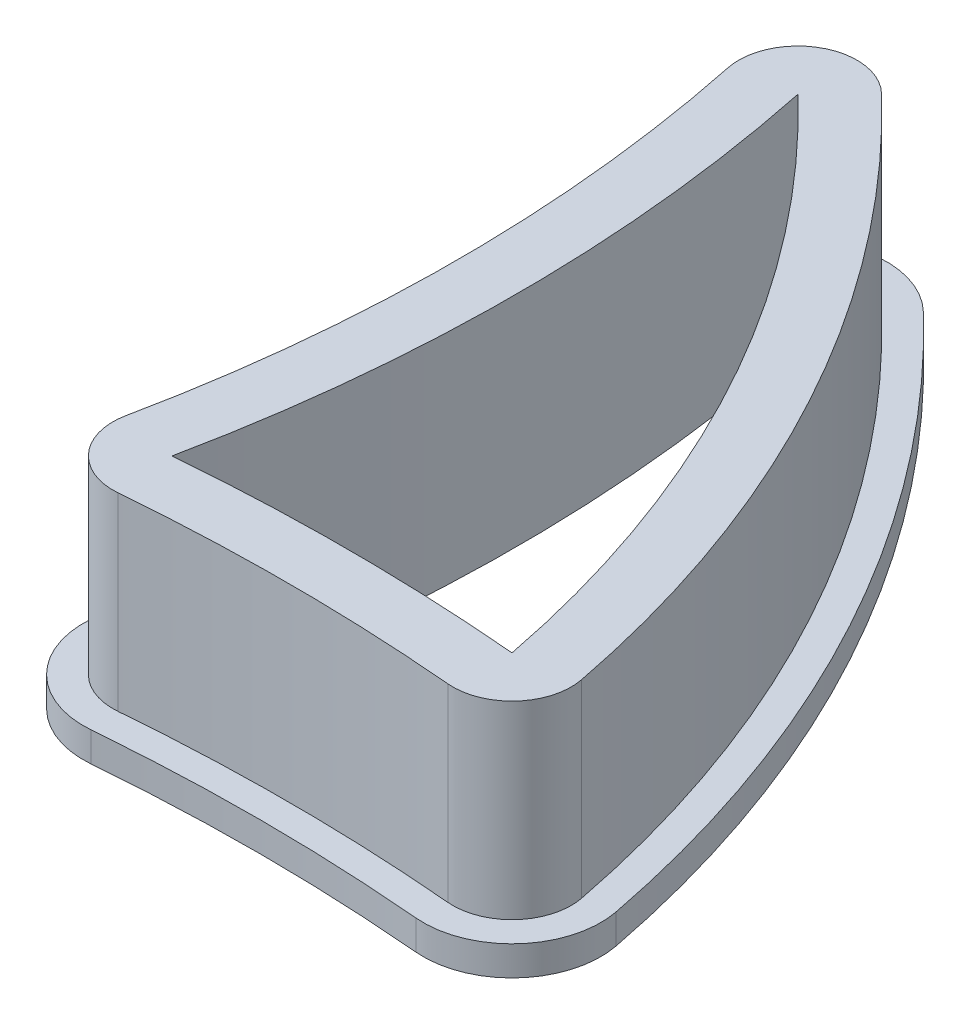
from build123d import *

# Parameters (mm, degrees)
EXTRUDE_7_DEPTH     = 6.4
EXTRUDE_8_DEPTH     = 1
FILLET_1_R          = 2
FILLET_4_R          = 3
CUT_EXTRUDE_1_DEPTH = 36.117222337


with BuildPart() as part:
    # 草图1 → 凸台-拉伸7 (new body)
    with BuildSketch(Plane(origin=(0, 0, 0), x_dir=(1, 0, 0), z_dir=(0, 1, 0))):
        with BuildLine():
            ThreePointArc((-8.25, 6.915846718), (0, 7.441530126), (8.25, 6.915846718))
            ThreePointArc((8.25, 6.915846718), (2.55299652, 23.258172204), (-9.25, 35.915846718))
            ThreePointArc((-9.25, 35.915846718), (-6.599997803, 21.489984725), (-8.25, 6.915846718))
        make_face()
        with BuildLine():
            ThreePointArc((-5.663467174, 30.373218023), (-4.570302184, 19.788295497), (-5.654744598, 9.202475772))
            ThreePointArc((-5.654744598, 9.202475772), (0.10266918, 9.441451462), (5.859323518, 9.184831872))
            ThreePointArc((5.859323518, 9.184831872), (1.732970319, 20.668203024), (-5.663467174, 30.373218023))
        make_face(mode=Mode.SUBTRACT)
    extrude(amount=EXTRUDE_7_DEPTH)

    # 草图1<9> → 凸台-拉伸8 (add)
    with BuildSketch(Plane(origin=(0, 0, 0), x_dir=(1, 0, 0), z_dir=(0, 1, 0))):
        with BuildLine():
            ThreePointArc((-11.257417673, 38.414736689), (-7.630939872, 22.203928266), (-9.628954872, 5.713034203))
            ThreePointArc((-9.628954872, 5.713034203), (-0.121629419, 6.44141455), (9.388395867, 5.749175976))
            ThreePointArc((9.388395867, 5.749175976), (2.941633426, 24.53181947), (-11.257417673, 38.414736689))
        make_face()
    extrude(amount=-EXTRUDE_8_DEPTH)

    # 圆角1
    fillet_1_edges = [part.edges().sort_by_distance(p)[0] for p in [
        (-8.25, 3.2, -6.915846718),
        (8.25, 3.2, -6.915846718),
        (-9.25, 3.2, -35.915846718),
    ]]
    fillet(fillet_1_edges, radius=FILLET_1_R)

    # 圆角4
    fillet_4_edges = [part.edges().sort_by_distance(p)[0] for p in [
        (-9.628954872, -0.5, -5.713034203),
        (9.388395867, -0.5, -5.749175976),
        (-11.257417673, -0.5, -38.414736689),
    ]]
    fillet(fillet_4_edges, radius=FILLET_4_R)

    # 草图1<10> → 切除-拉伸1 (cut, through all)
    with BuildSketch(Plane(origin=(0, 0, 0), x_dir=(1, 0, 0), z_dir=(0, 1, 0))):
        with BuildLine():
            ThreePointArc((5.859323518, 9.184831872), (1.732970319, 20.668203024), (-5.663467174, 30.373218023))
            ThreePointArc((-5.663467174, 30.373218023), (-4.570302184, 19.788295497), (-5.654744598, 9.202475772))
            ThreePointArc((-5.654744598, 9.202475772), (0.10266918, 9.441451462), (5.859323518, 9.184831872))
        make_face()
    extrude(amount=-CUT_EXTRUDE_1_DEPTH, mode=Mode.SUBTRACT)


solid = part.part
